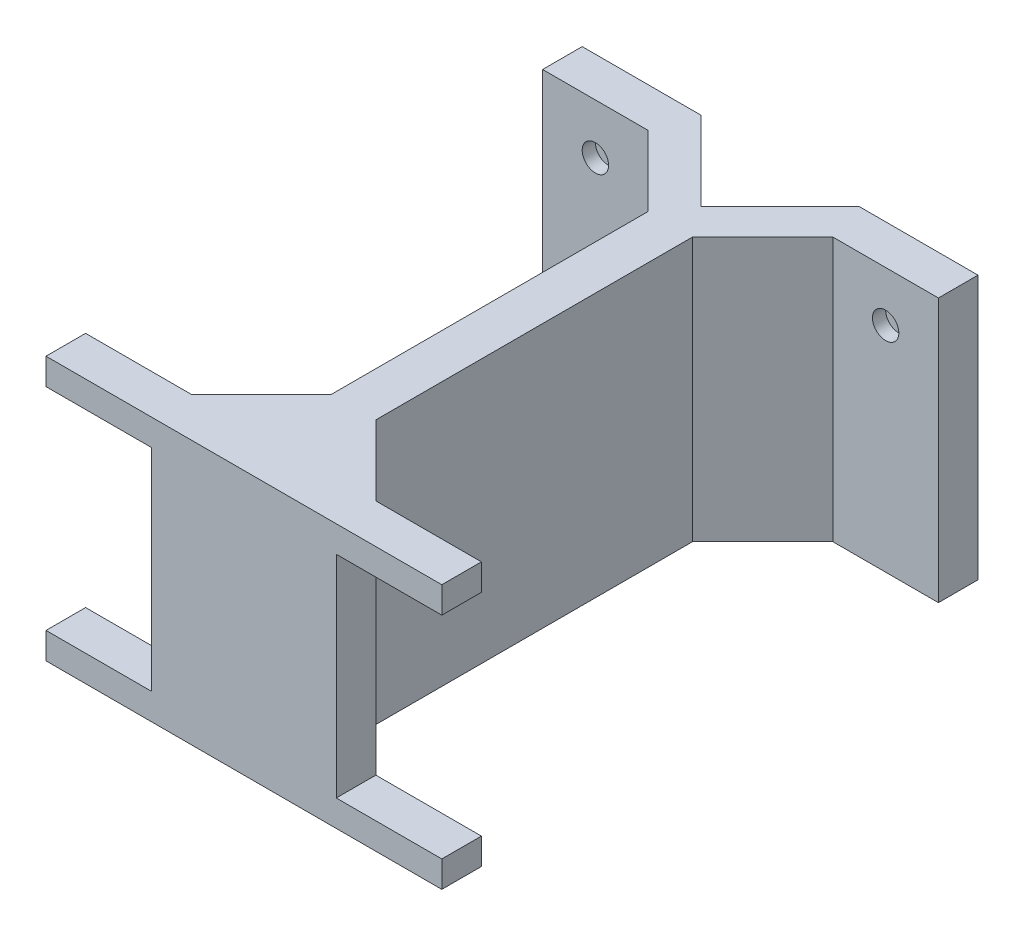
from build123d import *

# Parameters (mm, degrees)
SKETCH2_W           = 75
SKETCH2_H           = 50
BOSS_EXTRUDE1_DEPTH = 101.6
CUT_EXTRUDE1_DEPTH  = 101.6
CUT_EXTRUDE2_DEPTH  = 101.6
SKETCH5_W           = 20
SKETCH5_H           = 40
CUT_EXTRUDE3_DEPTH  = 10
SKETCH6_W           = 20
SKETCH6_H           = 40
CUT_EXTRUDE4_DEPTH  = 10
SKETCH7_R           = 2.5
CUT_EXTRUDE5_DEPTH  = 2.5
SKETCH8_R           = 2.5
CUT_EXTRUDE6_DEPTH  = 2.5
CUT_EXTRUDE7_DEPTH  = 121.365392665


with BuildPart() as part:
    # Sketch2 → Boss-Extrude1 (new body)
    with BuildSketch(Plane.XY):
        with Locations((-3.307692308, -6.81353022)):
            Rectangle(SKETCH2_W, SKETCH2_H)
    extrude(amount=BOSS_EXTRUDE1_DEPTH)

    # Sketch3 → Cut-Extrude1 (cut)
    with BuildSketch(Plane(origin=(0, 18.18646978, 0), x_dir=(1, 0, 0), z_dir=(0, 1, 0))):
        Polygon((-40.807692308, -7.5), (-20.807692308, -7.5), (-7.507692308, -20.8), (-7.507692308, -80.8), (-20.807692308, -94.1), (-40.807692308, -94.1), align=None)
    extrude(amount=-CUT_EXTRUDE1_DEPTH, mode=Mode.SUBTRACT)

    # Sketch4 → Cut-Extrude2 (cut)
    with BuildSketch(Plane(origin=(0, 18.18646978, 0), x_dir=(1, 0, 0), z_dir=(0, 1, 0))):
        Polygon((34.192307692, -94.1), (14.192307692, -94.1), (0.892307692, -80.8), (0.892307692, -20.8), (14.192307692, -7.5), (34.192307692, -7.5), align=None)
    extrude(amount=-CUT_EXTRUDE2_DEPTH, mode=Mode.SUBTRACT)

    # Sketch5 → Cut-Extrude3 (cut)
    with BuildSketch(Plane.XY.offset(101.6)):
        with Locations((24.192307692, -6.81353022)):
            Rectangle(SKETCH5_W, SKETCH5_H)
    extrude(amount=-CUT_EXTRUDE3_DEPTH, mode=Mode.SUBTRACT)

    # Sketch6 → Cut-Extrude4 (cut)
    with BuildSketch(Plane.XY.offset(101.6)):
        with Locations((-30.807692308, -6.81353022)):
            Rectangle(SKETCH6_W, SKETCH6_H)
    extrude(amount=-CUT_EXTRUDE4_DEPTH, mode=Mode.SUBTRACT)

    # Sketch7 → Cut-Extrude5 (cut)
    with BuildSketch(Plane.XY.offset(7.5)):
        with Locations((24.192307692, 8.68646978)):
            Circle(SKETCH7_R)
    extrude(amount=-CUT_EXTRUDE5_DEPTH, mode=Mode.SUBTRACT)

    # Sketch8 → Cut-Extrude6 (cut)
    with BuildSketch(Plane.XY.offset(7.5)):
        with Locations((-30.807692308, 8.68646978)):
            Circle(SKETCH8_R)
    extrude(amount=-CUT_EXTRUDE6_DEPTH, mode=Mode.SUBTRACT)

    # Sketch9 → Cut-Extrude7 (cut, through all)
    with BuildSketch(Plane(origin=(0, 18.18646978, 0), x_dir=(1, 0, 0), z_dir=(0, 1, 0))):
        Polygon((-18.24818848, 0), (-3.307692308, -14.940496172), (11.632803865, 0), align=None)
    extrude(amount=-CUT_EXTRUDE7_DEPTH, mode=Mode.SUBTRACT)


solid = part.part
